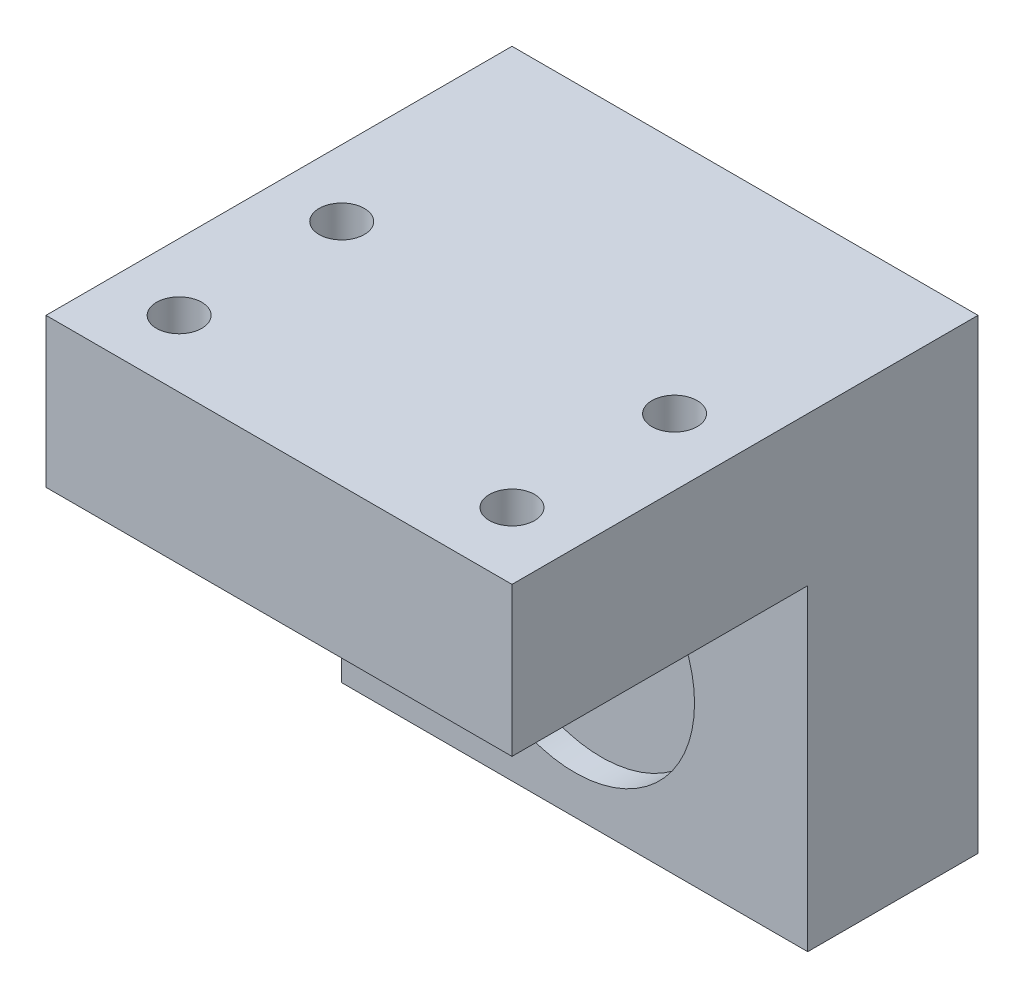
from build123d import *

# Parameters (mm, degrees)
BOSS_EXTRUDE1_DEPTH = 35
CUT_EXTRUDE1_REACH  = 56.252
SKETCH2_R           = 3
SKETCH2_4_R         = 9
CUT_EXTRUDE2_DEPTH  = 2
CUT_EXTRUDE3_REACH  = 49.804
SKETCH5_R           = 1.7


with BuildPart() as part:
    # Sketch1 → Boss-Extrude1 (new body)
    with BuildSketch(Plane.YZ):
        Polygon((0, -12.79), (35, -12.79), (35, 22.21), (23.81, 22.21), (23.81, 0), (0, 0), align=None)
    extrude(amount=BOSS_EXTRUDE1_DEPTH)

    # Sketch2 → Cut-Extrude1 (cut, up to next)
    with BuildSketch(Plane.XY, mode=Mode.PRIVATE) as cut_extrude1_sk1:
        with Locations((17.5, 11.905)):
            Circle(SKETCH2_R)
    cut_extrude1_tool1 = extrude(cut_extrude1_sk1.sketch, amount=-CUT_EXTRUDE1_REACH, mode=Mode.PRIVATE) & part.part
    add(cut_extrude1_tool1.solids().sort_by_distance((17.5, 11.905, 0))[0], mode=Mode.SUBTRACT)

    # Sketch2<4> → Cut-Extrude2 (cut)
    with BuildSketch(Plane.XY):
        with Locations((17.5, 11.905)):
            Circle(SKETCH2_4_R)
    extrude(amount=-CUT_EXTRUDE2_DEPTH, mode=Mode.SUBTRACT)

    # Sketch5 → Cut-Extrude3 (cut, up to next)
    with BuildSketch(Plane.XZ.offset(-23.81), mode=Mode.PRIVATE) as cut_extrude3_sk1:
        with Locations((5, 17.21)):
            Circle(SKETCH5_R)
    cut_extrude3_tool1 = extrude(cut_extrude3_sk1.sketch, amount=-CUT_EXTRUDE3_REACH, mode=Mode.PRIVATE) & part.part
    # Sketch5 → Cut-Extrude3 (cut, up to next)
    with BuildSketch(Plane.XZ.offset(-23.81), mode=Mode.PRIVATE) as cut_extrude3_sk2:
        with Locations((30, 17.21)):
            Circle(SKETCH5_R)
    cut_extrude3_tool2 = extrude(cut_extrude3_sk2.sketch, amount=-CUT_EXTRUDE3_REACH, mode=Mode.PRIVATE) & part.part
    # Sketch5 → Cut-Extrude3 (cut, up to next)
    with BuildSketch(Plane.XZ.offset(-23.81), mode=Mode.PRIVATE) as cut_extrude3_sk3:
        with Locations((30, 5)):
            Circle(SKETCH5_R)
    cut_extrude3_tool3 = extrude(cut_extrude3_sk3.sketch, amount=-CUT_EXTRUDE3_REACH, mode=Mode.PRIVATE) & part.part
    # Sketch5 → Cut-Extrude3 (cut, up to next)
    with BuildSketch(Plane.XZ.offset(-23.81), mode=Mode.PRIVATE) as cut_extrude3_sk4:
        with Locations((5, 5)):
            Circle(SKETCH5_R)
    cut_extrude3_tool4 = extrude(cut_extrude3_sk4.sketch, amount=-CUT_EXTRUDE3_REACH, mode=Mode.PRIVATE) & part.part
    add(cut_extrude3_tool1.solids().sort_by_distance((5, 23.81, 17.21))[0], mode=Mode.SUBTRACT)
    add(cut_extrude3_tool2.solids().sort_by_distance((30, 23.81, 17.21))[0], mode=Mode.SUBTRACT)
    add(cut_extrude3_tool3.solids().sort_by_distance((30, 23.81, 5))[0], mode=Mode.SUBTRACT)
    add(cut_extrude3_tool4.solids().sort_by_distance((5, 23.81, 5))[0], mode=Mode.SUBTRACT)


solid = part.part
